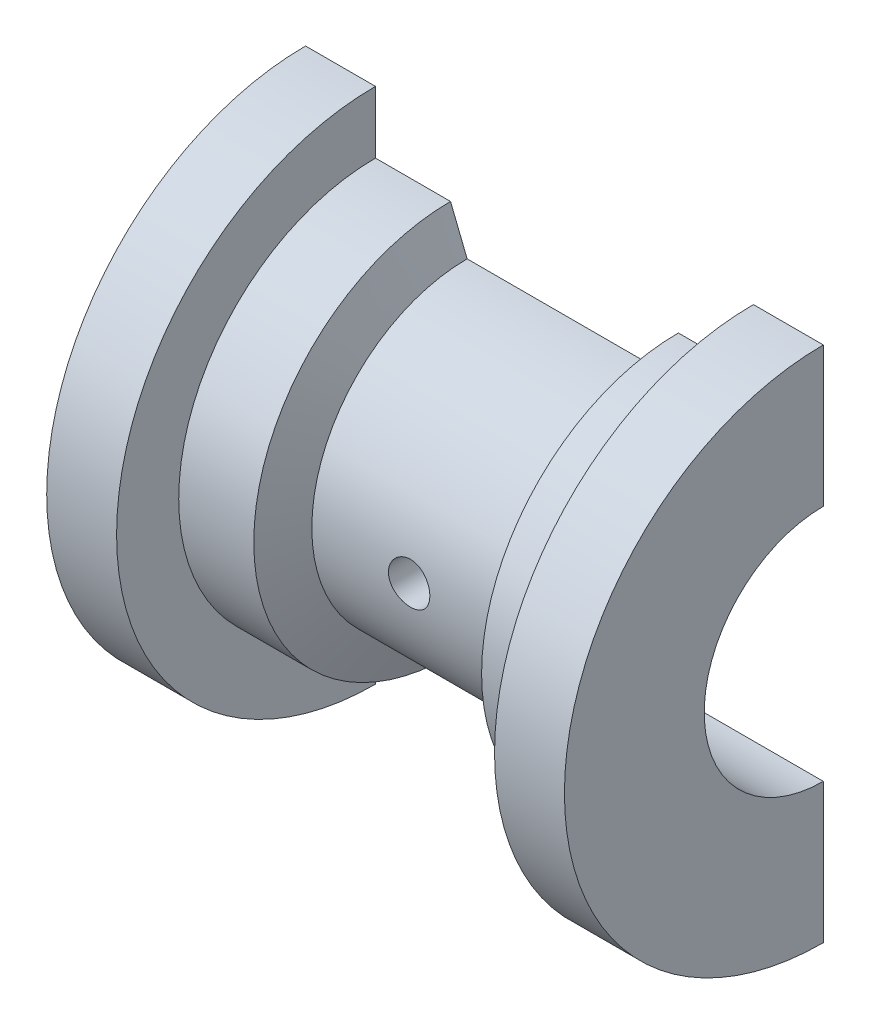
from build123d import *

# Parameters (mm, degrees)
REVOLVE1_ANGLE = 180
SKETCH3_W      = 2
SKETCH3_H      = 15


with BuildPart() as part:
    # Sketch1 → Revolve1 (revolve)
    with BuildSketch(Plane.XY):
        Polygon((-19.882341212, 25), (-19.882341212, 11.5), (30.117658788, 11.5), (30.117658788, 25), (23.367658788, 25), (23.367658788, 19), (16.117658788, 19), (14.512644781, 15), (-4.277327206, 15), (-5.882341212, 19), (-13.132341212, 19), (-13.132341212, 25), align=None)
    revolve(axis=Axis((-47.288030425, 0, 0), (1, 0, 0)), revolution_arc=REVOLVE1_ANGLE)

    # Sketch3 → Cut-Revolve1 (revolve, cut)
    with BuildSketch(Plane(origin=(0, 0, 0), x_dir=(1, 0, 0), z_dir=(0, 1, 0))):
        with Locations((4.117658788, -7.5)):
            Rectangle(SKETCH3_W, SKETCH3_H)
    revolve(axis=Axis((5.117658788, 0, 0), (0, 0, 1)), mode=Mode.SUBTRACT)


solid = part.part
